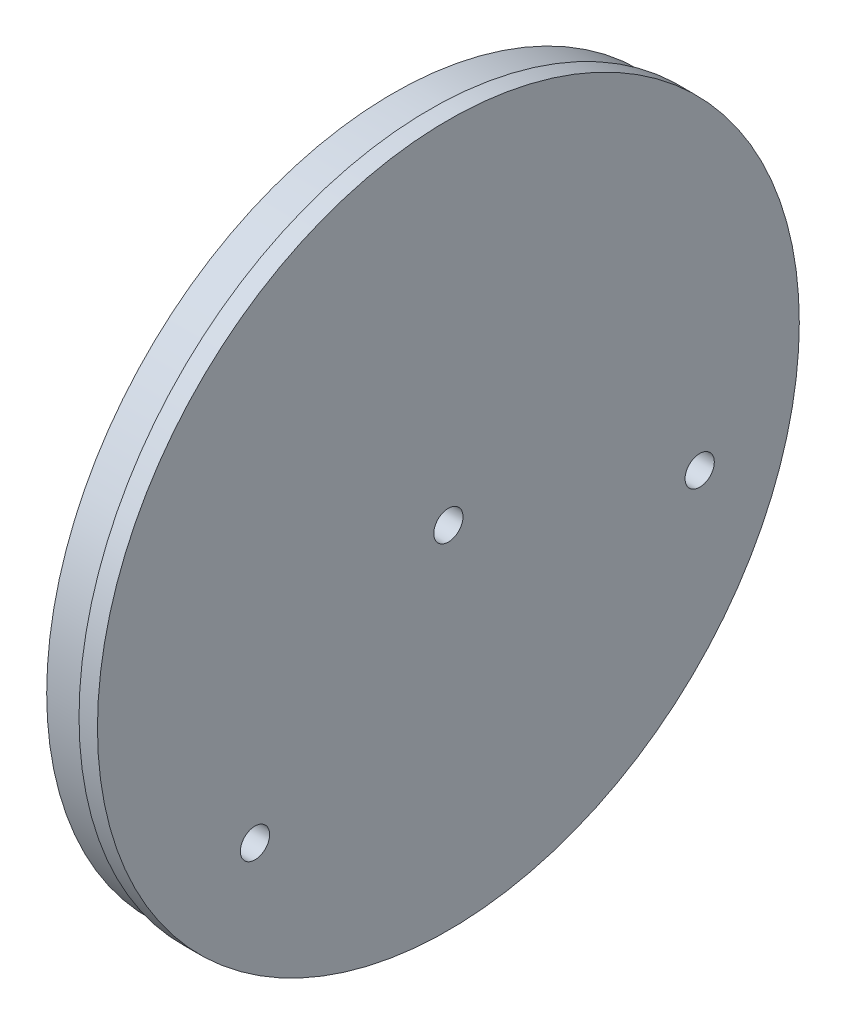
from build123d import *

# Parameters (mm, degrees)
SKETCH1_R           = 76.2
BOSS_EXTRUDE1_DEPTH = 12
SKETCH2_OUTSIDE_W   = 197.572
SKETCH2_OUTSIDE_H   = 197.572
SKETCH2_OUTSIDE_R   = 75.2221
CUT_EXTRUDE1_DEPTH  = 8
SKETCH3_R           = 3.175
CUT_EXTRUDE2_DEPTH  = 109.429147373
SKETCH5_R           = 3.175
CUT_EXTRUDE3_DEPTH  = 109.429147373
CIRPATTERN1_COUNT   = 3


with BuildPart() as part:
    # Sketch1 → Boss-Extrude1 (new body)
    with BuildSketch(Plane(origin=(0, 0, 0), x_dir=(0, 0, -1), z_dir=(1, 0, 0))):
        Circle(SKETCH1_R)
    extrude(amount=BOSS_EXTRUDE1_DEPTH)

    # Sketch2 outside → Cut-Extrude1 (cut)
    with BuildSketch(Plane.ZY):
        Rectangle(SKETCH2_OUTSIDE_W, SKETCH2_OUTSIDE_H)
        Circle(SKETCH2_OUTSIDE_R, mode=Mode.SUBTRACT)
    extrude(amount=-CUT_EXTRUDE1_DEPTH, mode=Mode.SUBTRACT)

    # Sketch3 → Cut-Extrude2 (cut, through all)
    with BuildSketch(Plane(origin=(12, 0, 0), x_dir=(0, 0, -1), z_dir=(1, 0, 0))):
        Circle(SKETCH3_R)
    extrude(amount=-CUT_EXTRUDE2_DEPTH, mode=Mode.SUBTRACT)

    # Sketch5 → Cut-Extrude3 (cut, through all)
    with BuildSketch(Plane(origin=(12, 0, 0), x_dir=(0, 0, -1), z_dir=(1, 0, 0))):
        with Locations((-41.99401686, -38.763707871)):
            Circle(SKETCH5_R)
    cut_extrude3 = extrude(amount=-CUT_EXTRUDE3_DEPTH, mode=Mode.SUBTRACT)

    # CirPattern1: Cut-Extrude3 ×3 about axis, 1 skipped
    cirpattern1_axis = Axis((12, 0, 0), (1, 0, 0))
    add([cut_extrude3.rotate(cirpattern1_axis, i * 360 / CIRPATTERN1_COUNT) for i in range(1, CIRPATTERN1_COUNT) if i not in (2,)], mode=Mode.SUBTRACT)


solid = part.part
